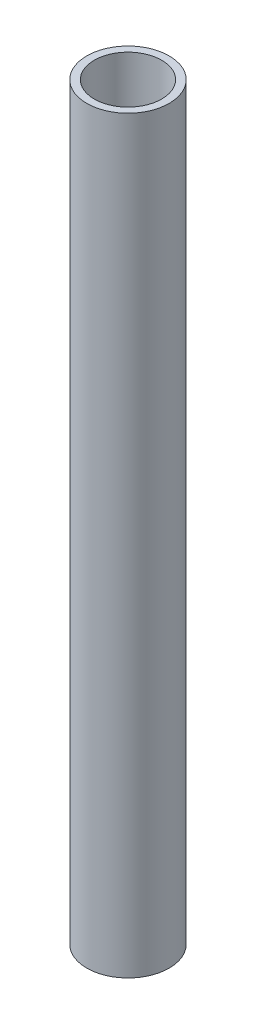
from build123d import *

# Parameters (mm, degrees)
SKETCH1_R           = 5.5
SKETCH1_R_2         = 4.5
BOSS_EXTRUDE1_DEPTH = 100


with BuildPart() as part:
    # Sketch1 → Boss-Extrude1 (new body)
    with BuildSketch(Plane(origin=(0, 0, 0), x_dir=(1, 0, 0), z_dir=(0, 1, 0))):
        with Locations(Location((0, 0, 0), (0, 0, 270))):
            Circle(SKETCH1_R)
        with Locations(Location((0, 0, 0), (0, 0, 270))):
            Circle(SKETCH1_R_2, mode=Mode.SUBTRACT)
    extrude(amount=BOSS_EXTRUDE1_DEPTH)


solid = part.part
